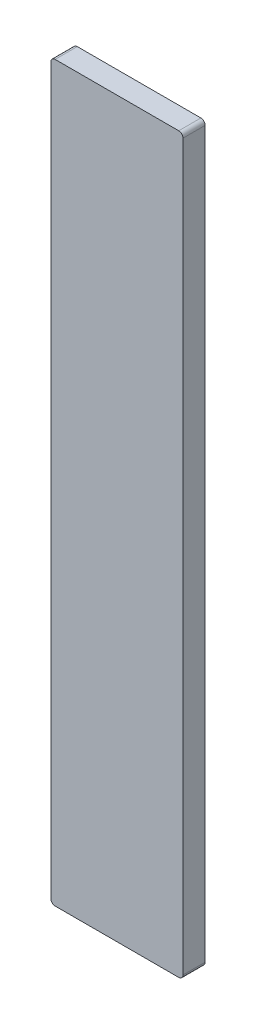
from build123d import *

# Parameters (mm, degrees)
SKETCH1_W           = 155
SKETCH1_H           = 860
BOSS_EXTRUDE1_DEPTH = 26
FILLET1_R           = 5
FILLET2_R           = 5
FILLET3_R           = 5
FILLET4_R           = 5


with BuildPart() as part:
    # Sketch1 → Boss-Extrude1 (new body)
    with BuildSketch(Plane.XY):
        with Locations((77.5, 430)):
            Rectangle(SKETCH1_W, SKETCH1_H)
    extrude(amount=BOSS_EXTRUDE1_DEPTH)

    # Fillet1
    fillet1_edges = [part.edges().sort_by_distance(p)[0] for p in [
        (0, 860, 13),
    ]]
    fillet(fillet1_edges, radius=FILLET1_R)

    # Fillet2
    fillet2_edges = [part.edges().sort_by_distance(p)[0] for p in [
        (155, 860, 13),
    ]]
    fillet(fillet2_edges, radius=FILLET2_R)

    # Fillet3
    fillet3_edges = [part.edges().sort_by_distance(p)[0] for p in [
        (155, 0, 13),
    ]]
    fillet(fillet3_edges, radius=FILLET3_R)

    # Fillet4
    fillet4_edges = [part.edges().sort_by_distance(p)[0] for p in [
        (0, 0, 13),
    ]]
    fillet(fillet4_edges, radius=FILLET4_R)


with BuildPart() as part_1:
    # Body-Move/Copy1: moved
    add(part.part.moved(Location((0, 0, -19.05))))


with BuildPart() as part_2:
    # Body-Move/Copy2: moved
    add(part_1.part.moved(Location((0, 0, -6.95))))


solid = part_2.part
